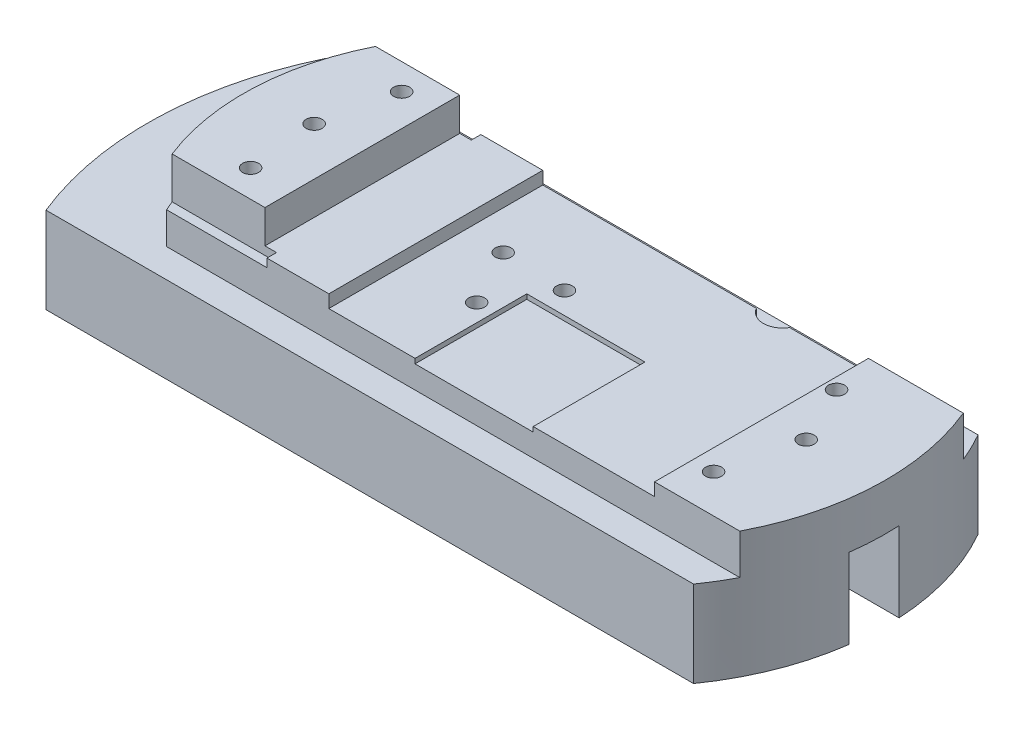
from build123d import *
from build123d.topology import SkipClean

# Parameters (mm, degrees)
SKETCH1_W           = 195
SKETCH1_H           = 67
BOSS_EXTRUDE1_DEPTH = 50
CUT_EXTRUDE1_DEPTH  = 115.579666608
CUT_EXTRUDE2_DEPTH  = 129.433835106
CUT_EXTRUDE3_START  = -13
SKETCH4_W           = 3.612655346
SKETCH4_H           = 3
CUT_EXTRUDE3_DEPTH  = 13
SKETCH6_R           = 2.5
CUT_EXTRUDE4_DEPTH  = 115.579666608
SKETCH7_W           = 37
SKETCH7_H           = 35
CUT_EXTRUDE5_DEPTH  = 1.5
CUT_EXTRUDE6_DEPTH  = 18.5
SKETCH9_R           = 2.5
CUT_EXTRUDE7_DEPTH  = 25
BOSS_EXTRUDE2_START = 25
BOSS_EXTRUDE2_DEPTH = 25
BOSS_EXTRUDE3_DEPTH = 2


with BuildPart() as part:
    # Sketch1 → Boss-Extrude1 (new body)
    with BuildSketch(Plane(origin=(0, 0, 0), x_dir=(1, 0, 0), z_dir=(0, 1, 0))):
        Rectangle(SKETCH1_W, SKETCH1_H)
    extrude(amount=BOSS_EXTRUDE1_DEPTH)

    # Sketch2 → Cut-Extrude1 (cut, through all)
    with BuildSketch(Plane.XZ):
        with BuildLine():
            Line((97.5, -3.219751644), (97.5, 33.5))
            Line((97.5, 33.5), (88.5, 33.5))
            ThreePointArc((88.5, 33.5), (95.217186872, 15.683556008), (97.5, -3.219751644))
        make_face()
        with BuildLine():
            Line((97.5, -33.5), (97.5, -3.219751644))
            ThreePointArc((97.5, -3.219751644), (95.985558513, -18.65423771), (91.5, -33.5))
            Line((91.5, -33.5), (97.5, -33.5))
        make_face()
        with BuildLine():
            ThreePointArc((-88, -33.5), (-95.08607052, -15.861694529), (-97.5, 2.992884749))
            Line((-97.5, 2.992884749), (-97.5, -33.5))
            Line((-97.5, -33.5), (-88, -33.5))
        make_face()
        with BuildLine():
            ThreePointArc((-97.5, 2.992884749), (-95.856964648, 18.588830376), (-91, 33.5))
            Line((-91, 33.5), (-97.5, 33.5))
            Line((-97.5, 33.5), (-97.5, 2.992884749))
        make_face()
    extrude(amount=-CUT_EXTRUDE1_DEPTH, mode=Mode.SUBTRACT)

    # Sketch3 → Cut-Extrude2 (cut, through all)
    with BuildSketch(Plane(origin=(0, 0, 33.5), x_dir=(-1, 0, 0), z_dir=(0, 0, -1))):
        Polygon((63.2, 50), (63.2, 39.6), (40.2, 39.6), (40.2, 35.6), (-61.8, 35.6), (-61.8, 39.6), (-97.5, 39.6), (-97.5, 50), align=None)
    extrude(amount=CUT_EXTRUDE2_DEPTH, mode=Mode.SUBTRACT)

    # Sketch4 → Cut-Extrude3 (cut)
    with BuildSketch(Plane(origin=(0, 50, 0), x_dir=(1, 0, 0), z_dir=(0, 1, 0)).offset(CUT_EXTRUDE3_START)):
        with BuildLine():
            Line((-63.2, 30.5), (-63.2, 33.5))
            Line((-63.2, 33.5), (-88, 33.5))
            ThreePointArc((-88, 33.5), (-88.810680862, 32.008999469), (-89.587344654, 30.5))
            Line((-89.587344654, 30.5), (-63.2, 30.5))
        make_face()
        with Locations((-61.393672327, 32)):
            Rectangle(SKETCH4_W, SKETCH4_H)
        with BuildLine():
            Line((-63.2, -33.5), (-63.2, -30.5))
            Line((-63.2, -30.5), (-92.261692194, -30.5))
            ThreePointArc((-92.261692194, -30.5), (-91.647155152, -32.006859002), (-91, -33.5))
            Line((-91, -33.5), (-63.2, -33.5))
        make_face()
        with Locations((-61.393672327, -32)):
            Rectangle(SKETCH4_W, SKETCH4_H)
    extrude(amount=CUT_EXTRUDE3_DEPTH, mode=Mode.SUBTRACT)

    # Sketch6 → Cut-Extrude4 (cut, through all)
    with BuildSketch(Plane.XZ):
        with Locations(Location((-28.1, -9, 0), (0, 0, 270))):
            Circle(SKETCH6_R)
        with Locations(Location((-8.2, -8.3, 0), (0, 0, 270))):
            Circle(SKETCH6_R)
        with Locations(Location((-18.7, 8.7, 0), (0, 0, 270))):
            Circle(SKETCH6_R)
        with Locations(Location((-76.2, 22, 0), (0, 0, 270))):
            Circle(SKETCH6_R)
        with Locations(Location((-78.2, 0.1, 0), (0, 0, 270))):
            Circle(SKETCH6_R)
        with Locations(Location((-73.2, -22.3, 0), (0, 0, 270))):
            Circle(SKETCH6_R)
        with Locations(Location((65.3, -20, 0), (0, 0, 270))):
            Circle(SKETCH6_R)
        with Locations(Location((74.1, -1.7, 0), (0, 0, 270))):
            Circle(SKETCH6_R)
        with Locations(Location((68.3, 21.5, 0), (0, 0, 270))):
            Circle(SKETCH6_R)
    extrude(amount=-CUT_EXTRUDE4_DEPTH, mode=Mode.SUBTRACT)

    # Sketch7 → Cut-Extrude5 (cut)
    with BuildSketch(Plane(origin=(0, 35.6, 0), x_dir=(1, 0, 0), z_dir=(0, 1, 0))):
        with Locations((5.3, -16)):
            Rectangle(SKETCH7_W, SKETCH7_H)
    extrude(amount=-CUT_EXTRUDE5_DEPTH, mode=Mode.SUBTRACT)

    # Sketch8 → Cut-Extrude6 (cut)
    with BuildSketch(Plane(origin=(0, 50, 0), x_dir=(1, 0, 0), z_dir=(0, 1, 0))):
        with BuildLine():
            Line((37.096152423, 33.5), (31.9, 33.5))
            Line((31.9, 33.5), (31.9, 30.5))
            ThreePointArc((31.9, 30.5), (34.9, 31.303847577), (37.096152423, 33.5))
        make_face()
        with BuildLine():
            Line((31.9, 33.5), (26.703847577, 33.5))
            ThreePointArc((26.703847577, 33.5), (28.9, 31.303847577), (31.9, 30.5))
            Line((31.9, 30.5), (31.9, 33.5))
        make_face()
    extrude(amount=-CUT_EXTRUDE6_DEPTH, mode=Mode.SUBTRACT)

    # Sketch9 → Cut-Extrude7 (cut)
    with BuildSketch(Plane.XZ):
        with BuildLine():
            Line((-2.396551724, 28.5), (-81.585940529, 28.5))
            ThreePointArc((-81.585940529, 28.5), (-82.773060502, 28.814676047), (-83.648434047, 29.676067945))
            ThreePointArc((-83.648434047, 29.676067945), (-85.016854467, 31.683550399), (-86.630258043, 33.5))
            Line((-86.630258043, 33.5), (-91, 33.5))
            ThreePointArc((-91, 33.5), (-96.041663789, 17.695271398), (-97.477752055, 1.168158207))
            ThreePointArc((-97.477752055, 1.168158207), (-95.332095511, 1.5823273), (-93.248186912, 2.240128941))
            ThreePointArc((-93.248186912, 2.240128941), (-90, -7e-09), (-93.248186926, -2.240128936))
            ThreePointArc((-93.248186926, -2.240128936), (-95.286014537, -1.594067776), (-97.383519589, -1.181019415))
            ThreePointArc((-97.383519589, -1.181019415), (-94.531917422, -17.874782597), (-88, -33.5))
            Line((-88, -33.5), (-86.630258043, -33.5))
            ThreePointArc((-86.630258043, -33.5), (-85.016854382, -31.683550291), (-83.648433906, -29.676067708))
            ThreePointArc((-83.648433906, -29.676067708), (-82.773060382, -28.814675978), (-81.585940529, -28.5))
            Line((-81.585940529, -28.5), (-2.396551708, -28.5))
            ThreePointArc((-2.396551708, -28.5), (-0.701933743, -27.798066246), (0, -26.103448276))
            Line((0, -26.103448276), (0, -9.896551726))
            ThreePointArc((0, -9.896551726), (0.701933748, -8.201933749), (2.396551724, -7.5))
            Line((2.396551724, -7.5), (97.384558849, -7.5))
            ThreePointArc((97.384558849, -7.5), (97.434108416, 0.014482123), (96.773110049, 7.5))
            Line((96.773110049, 7.5), (2.396551724, 7.5))
            ThreePointArc((2.396551724, 7.5), (0.70193375, 8.201933747), (0, 9.896551721))
            Line((0, 9.896551721), (0, 26.103448276))
            ThreePointArc((0, 26.103448276), (-0.701933749, 27.798066251), (-2.396551724, 28.5))
        make_face()
        with Locations(Location((-73.2, -22.3, 0), (0, 0, 270))):
            Circle(SKETCH9_R, mode=Mode.SUBTRACT)
        with Locations(Location((-78.2, 0.1, 0), (0, 0, 270))):
            Circle(SKETCH9_R, mode=Mode.SUBTRACT)
        with Locations(Location((-28.1, -9, 0), (0, 0, 270))):
            Circle(SKETCH9_R, mode=Mode.SUBTRACT)
        with Locations(Location((-8.2, -8.3, 0), (0, 0, 270))):
            Circle(SKETCH9_R, mode=Mode.SUBTRACT)
        with Locations(Location((-76.2, 22, 0), (0, 0, 270))):
            Circle(SKETCH9_R, mode=Mode.SUBTRACT)
        with Locations(Location((-18.7, 8.7, 0), (0, 0, 270))):
            Circle(SKETCH9_R, mode=Mode.SUBTRACT)
        with Locations(Location((74.1, -1.7, 0), (0, 0, 270))):
            Circle(SKETCH9_R, mode=Mode.SUBTRACT)
    extrude(amount=-CUT_EXTRUDE7_DEPTH, mode=Mode.SUBTRACT)

    # Sketch10 → Boss-Extrude2 (add)
    with SkipClean():  # the faces are left unmerged after this step: merging them gives an invalid solid
        with BuildSketch(Plane.XZ.offset(-25).offset(BOSS_EXTRUDE2_START)):
            with BuildLine():
                ThreePointArc((-97.477752055, 1.168158207), (-118.013212767, 26.043522633), (-86.630258043, 33.5))
                Line((-86.630258043, 33.5), (88.5, 33.5))
                ThreePointArc((88.5, 33.5), (85.908246666, 38.091048485), (83.017561959, 42.5))
                Line((83.017561959, 42.5), (-119.771431792, 42.5))
                ThreePointArc((-119.771431792, 42.5), (-127.448858613, -0.281382159), (-117.115521807, -42.5))
                Line((-117.115521807, -42.5), (87.104231658, -42.5))
                ThreePointArc((87.104231658, -42.5), (89.444159442, -38.069376757), (91.5, -33.5))
                Line((91.5, -33.5), (-86.630258043, -33.5))
                ThreePointArc((-86.630258043, -33.5), (-118.028282029, -25.998420382), (-97.383519589, -1.181019415))
                ThreePointArc((-97.383519589, -1.181019415), (-97.43986106, -0.006800655), (-97.477752055, 1.168158207))
            make_face()
        extrude(amount=-BOSS_EXTRUDE2_DEPTH)

    # Sketch11 → Boss-Extrude3 (add)
    with SkipClean():  # the faces are left unmerged after this step: merging them gives an invalid solid
        with BuildSketch(Plane(origin=(0, 25, 0), x_dir=(1, 0, 0), z_dir=(0, 1, 0))):
            with BuildLine():
                ThreePointArc((83.017561959, -42.5), (85.908246666, -38.091048485), (88.5, -33.5))
                Line((88.5, -33.5), (-91, -33.5))
                ThreePointArc((-91, -33.5), (-97.425088146, 0.354854693), (-88, 33.5))
                Line((-88, 33.5), (91.5, 33.5))
                ThreePointArc((91.5, 33.5), (89.444159442, 38.069376757), (87.104231658, 42.5))
                Line((87.104231658, 42.5), (-117.115521807, 42.5))
                ThreePointArc((-117.115521807, 42.5), (-127.448858613, 0.281382159), (-119.771431792, -42.5))
                Line((-119.771431792, -42.5), (83.017561959, -42.5))
            make_face()
        extrude(amount=BOSS_EXTRUDE3_DEPTH)


solid = part.part
